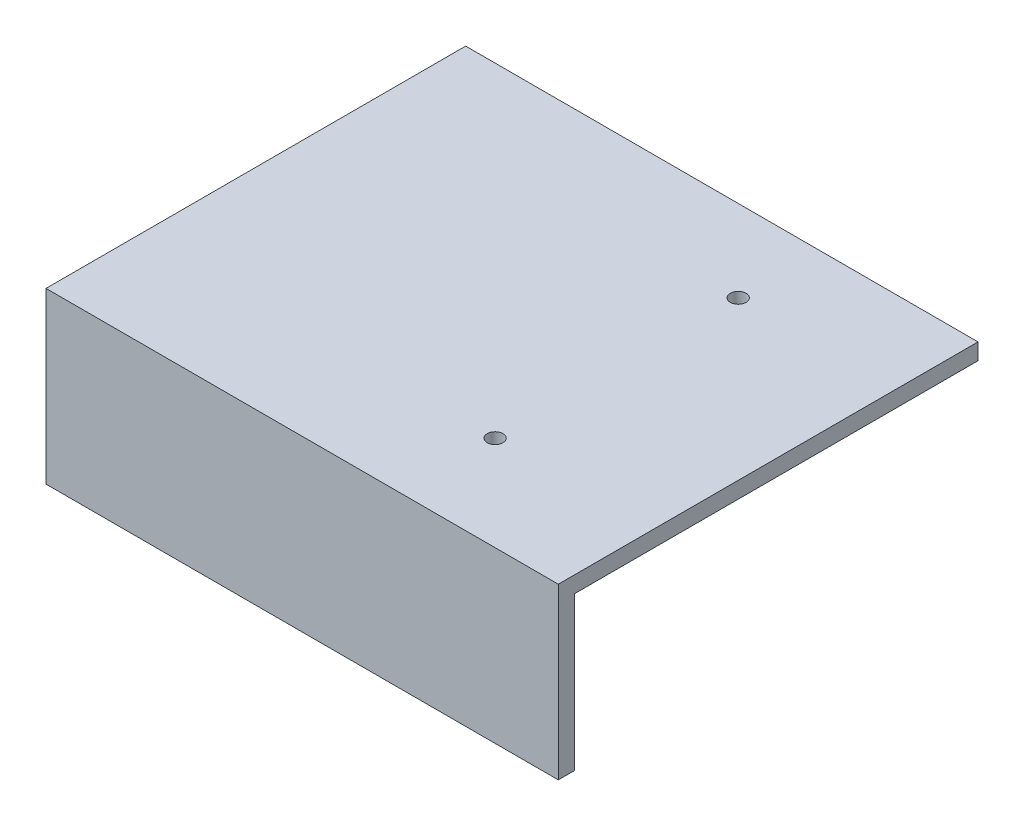
from build123d import *

# Parameters (mm, degrees)
SKETCH1_W           = 94
SKETCH1_H           = 77
BOSS_EXTRUDE1_DEPTH = 3
SKETCH2_W           = 94
SKETCH2_H           = 3
BOSS_EXTRUDE2_DEPTH = 28.1
SKETCH3_R           = 1.45
CUT_EXTRUDE1_DEPTH  = 69.252912026
LPATTERN1_COUNT     = 2
LPATTERN1_PITCH     = 44.6


with BuildPart() as part:
    # Sketch1 → Boss-Extrude1 (new body)
    with BuildSketch(Plane(origin=(0, 0, 0), x_dir=(1, 0, 0), z_dir=(0, 1, 0))):
        Rectangle(SKETCH1_W, SKETCH1_H)
    extrude(amount=BOSS_EXTRUDE1_DEPTH)

    # Sketch2 → Boss-Extrude2 (add)
    with BuildSketch(Plane.XZ):
        with Locations((0, 37)):
            Rectangle(SKETCH2_W, SKETCH2_H)
    extrude(amount=BOSS_EXTRUDE2_DEPTH)

    # Sketch3 → Cut-Extrude1 (cut, through all)
    with BuildSketch(Plane(origin=(0, 3, 0), x_dir=(1, 0, 0), z_dir=(0, 1, 0))):
        with Locations(Location((18, 23.5, 0), (0, 0, 270))):
            Circle(SKETCH3_R)
    cut_extrude1 = extrude(amount=-CUT_EXTRUDE1_DEPTH, mode=Mode.SUBTRACT)

    # LPattern1: Cut-Extrude1 ×2
    with Locations(*[(0, 0, i * LPATTERN1_PITCH) for i in range(1, LPATTERN1_COUNT)]):
        add(cut_extrude1, mode=Mode.SUBTRACT)


solid = part.part
